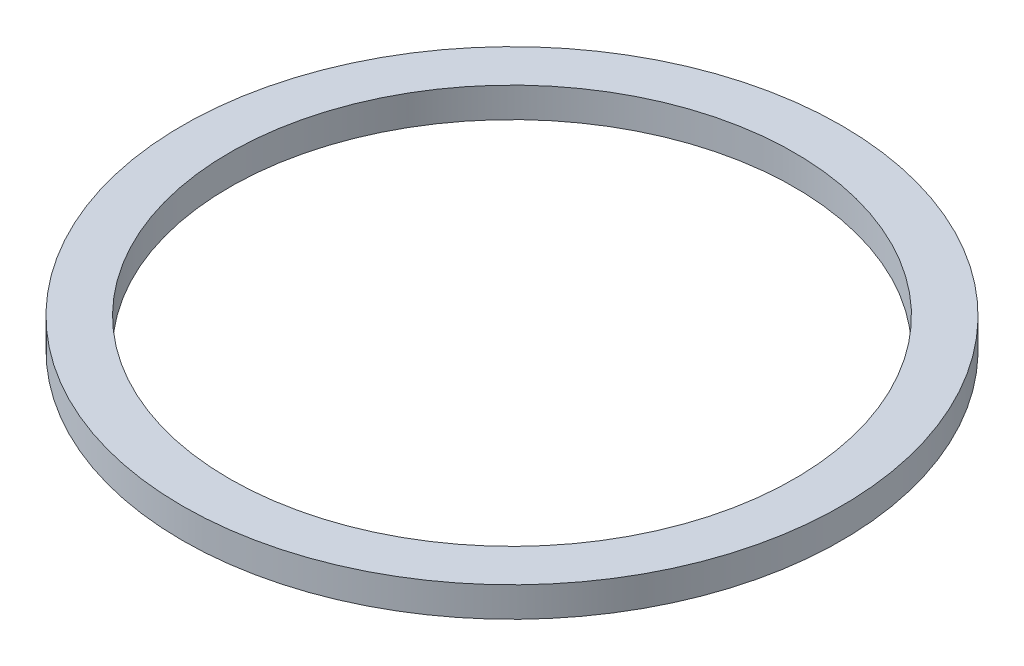
from build123d import *

# Parameters (mm, degrees)
SKETCH1_R           = 17.5
SKETCH1_R_2         = 15
BOSS_EXTRUDE1_DEPTH = 1.5875


with BuildPart() as part:
    # Sketch1 → Boss-Extrude1 (new body)
    with BuildSketch(Plane(origin=(0, 0, 0), x_dir=(1, 0, 0), z_dir=(0, 1, 0))):
        with Locations(Location((0, 0, 0), (0, 0, 270))):
            Circle(SKETCH1_R)
        with Locations(Location((0, 0, 0), (0, 0, 270))):
            Circle(SKETCH1_R_2, mode=Mode.SUBTRACT)
    extrude(amount=BOSS_EXTRUDE1_DEPTH)


solid = part.part
